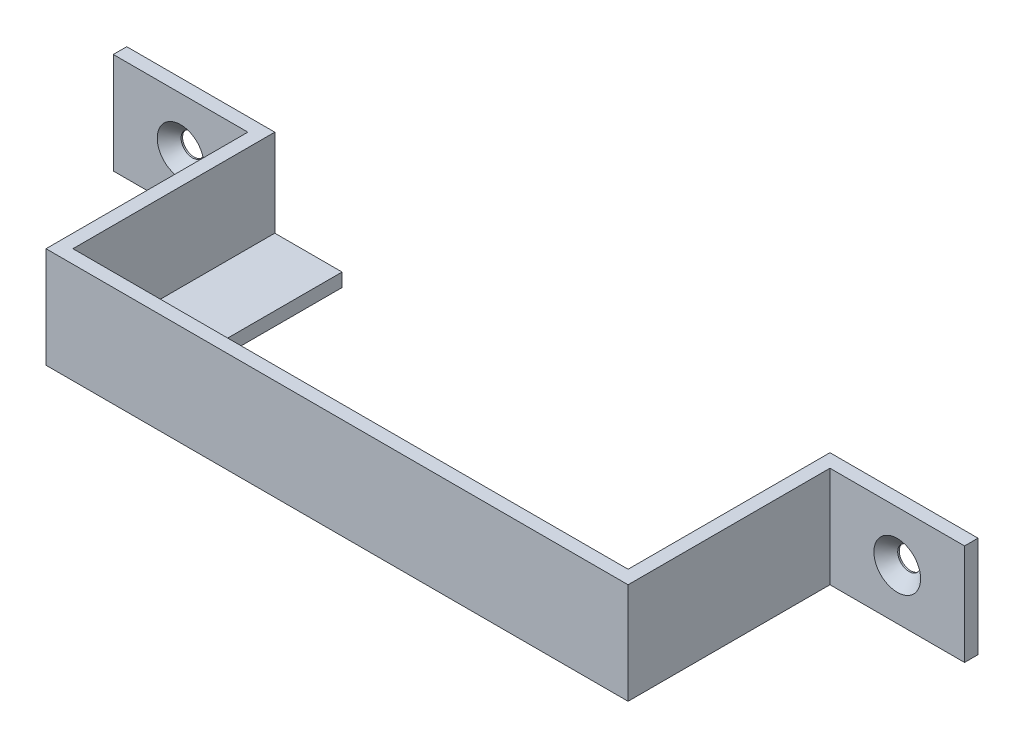
from build123d import *

# Parameters (mm, degrees)
AUFSATZ_LINEAR_AUSTRAGEN1_DEPTH                      = 15
AUFSATZ_LINEAR_AUSTRAGEN2_DEPTH                      = 2
FORMSENKUNG_F_R_M3_SENKSCHRAUBE_MIT_INNE_D           = 3.4
FORMSENKUNG_F_R_M3_SENKSCHRAUBE_MIT_INNE_DEPTH       = 10
FORMSENKUNG_F_R_M3_SENKSCHRAUBE_MIT_INNE_CSINK_D     = 6.94
FORMSENKUNG_F_R_M3_SENKSCHRAUBE_MIT_INNE_CSINK_ANGLE = 90
FORMSENKUNG_F_R_M3_SENKSCHRAUBE_MIT_INNE_TIP         = 1.021463052


with BuildPart() as part:
    # Skizze1 → Aufsatz-Linear austragen1 (new body)
    with BuildSketch(Plane(origin=(0, 0, 0), x_dir=(1, 0, 0), z_dir=(0, 1, 0))):
        Polygon((0, 0), (22, 0), (22, -30), (104.5, -30), (104.5, 0), (126.5, 0), (126.5, -2), (106.5, -2), (106.5, -32), (20, -32), (20, -2), (0, -2), align=None)
    extrude(amount=AUFSATZ_LINEAR_AUSTRAGEN1_DEPTH)

    # Skizze2 → Aufsatz-Linear austragen2 (add)
    with BuildSketch(Plane.XZ):
        Polygon((22, 0), (32, 0), (32, 25), (94.5, 25), (94.5, 0), (104.5, 0), (104.5, 30), (22, 30), align=None)
    extrude(amount=-AUFSATZ_LINEAR_AUSTRAGEN2_DEPTH)

    # Formsenkung für M3 Senkschraube mit Innensechskant1
    with Locations(Plane.XY.offset(2)):
        with Locations((10, 7.5), (116.5, 7.5)):
            CounterSinkHole(FORMSENKUNG_F_R_M3_SENKSCHRAUBE_MIT_INNE_D / 2, FORMSENKUNG_F_R_M3_SENKSCHRAUBE_MIT_INNE_CSINK_D / 2, depth=FORMSENKUNG_F_R_M3_SENKSCHRAUBE_MIT_INNE_DEPTH, counter_sink_angle=FORMSENKUNG_F_R_M3_SENKSCHRAUBE_MIT_INNE_CSINK_ANGLE)
            with Locations((0, 0, -(FORMSENKUNG_F_R_M3_SENKSCHRAUBE_MIT_INNE_DEPTH + FORMSENKUNG_F_R_M3_SENKSCHRAUBE_MIT_INNE_TIP / 2))):  # 118° drill point
                Cone(0, FORMSENKUNG_F_R_M3_SENKSCHRAUBE_MIT_INNE_D / 2, FORMSENKUNG_F_R_M3_SENKSCHRAUBE_MIT_INNE_TIP, mode=Mode.SUBTRACT)


solid = part.part
